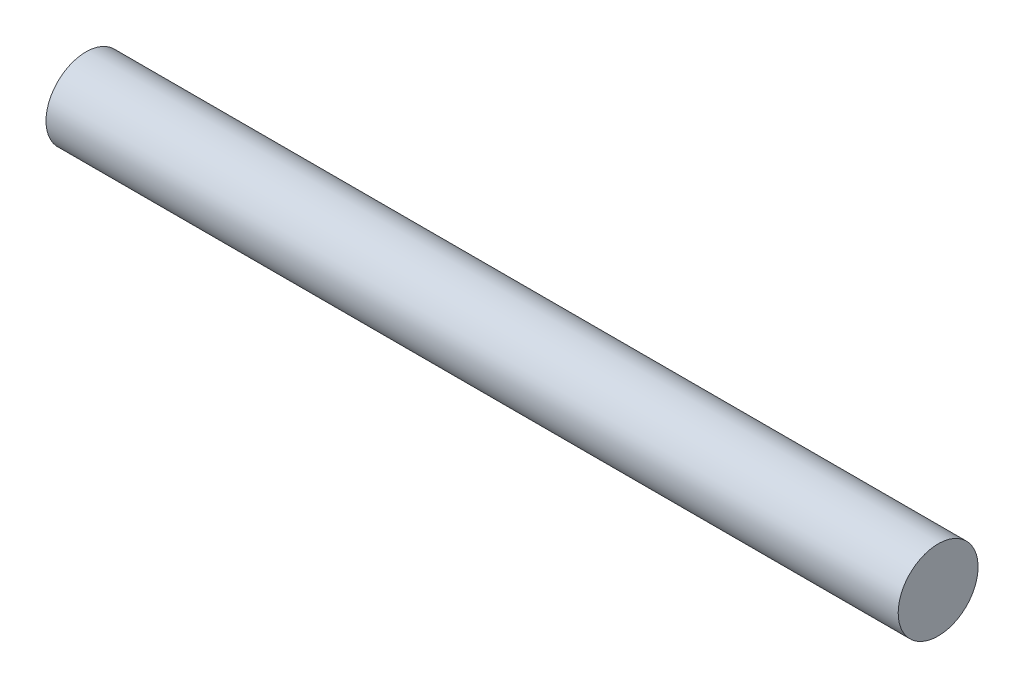
from build123d import *

# Parameters (mm, degrees)
SKETCH1_W = 32
SKETCH1_H = 1.5


with BuildPart() as part:
    # Sketch1 → Revolve1 (revolve)
    with BuildSketch(Plane.XY, mode=Mode.PRIVATE) as revolve1_sk:
        Rectangle(SKETCH1_W, SKETCH1_H)
    revolve(revolve1_sk.sketch.rotate(Axis((-16, -0.75, 0), (1, 0, 0)), 90), axis=Axis((-16, -0.75, 0), (1, 0, 0)))


solid = part.part
